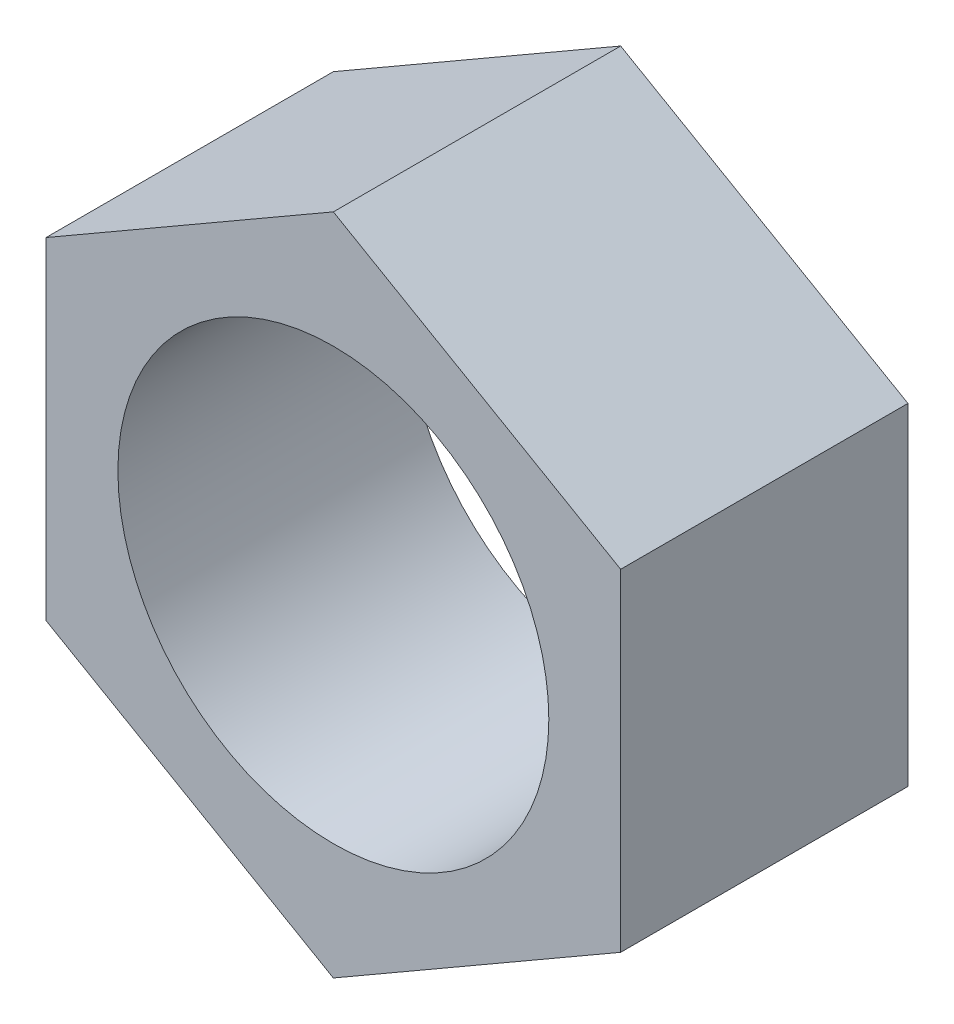
from build123d import *

# Parameters (mm, degrees)
SKETCH1_R           = 7.5
BOSS_EXTRUDE1_DEPTH = 10


with BuildPart() as part:
    # Sketch1 → Boss-Extrude1 (new body)
    with BuildSketch(Plane.XY):
        Polygon((10, -5.773502692), (10, 5.773502692), (0, 11.547005384), (-10, 5.773502692), (-10, -5.773502692), (0, -11.547005384), align=None)
        Circle(SKETCH1_R, mode=Mode.SUBTRACT)
    extrude(amount=BOSS_EXTRUDE1_DEPTH)


solid = part.part
